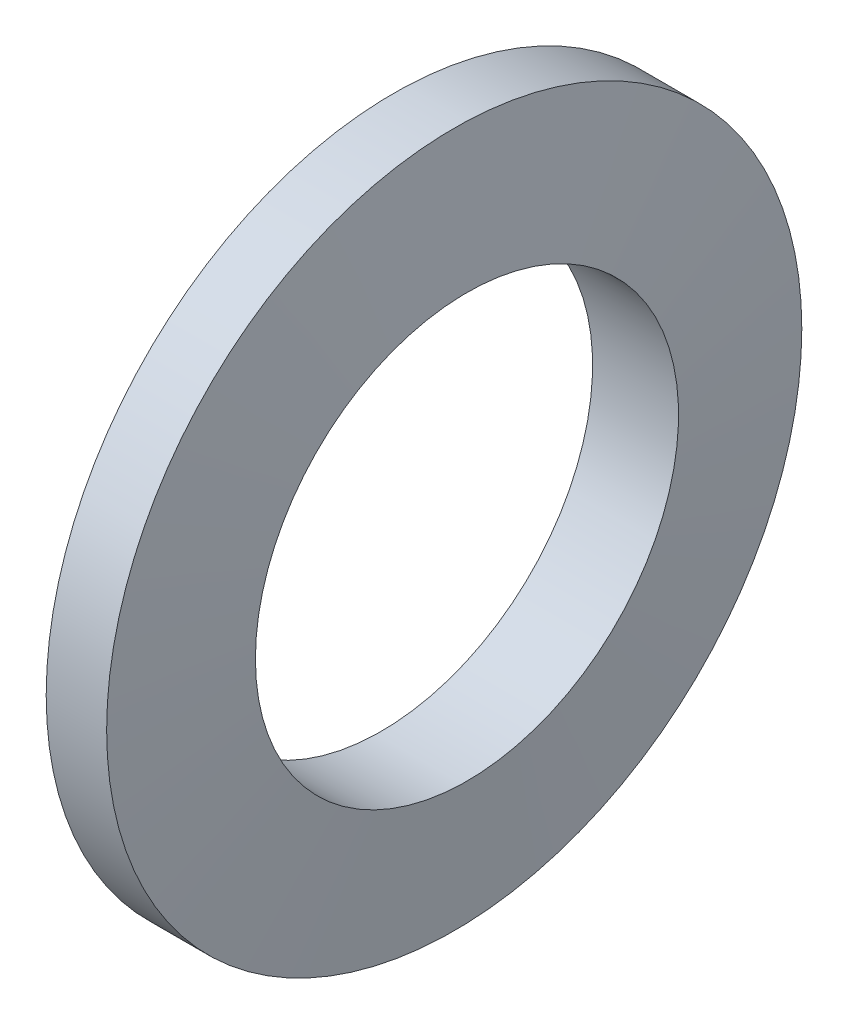
from build123d import *


with BuildPart() as part:
    # 草图1 → 旋转1 (revolve)
    with BuildSketch(Plane.XY, mode=Mode.PRIVATE) as revolve_1_sk:
        Polygon((-2, 23), (2, 23), (2.84375, 14), (-2.84375, 14), align=None)
    revolve(revolve_1_sk.sketch.rotate(Axis((0, 0, 0), (1, 0, 0)), 90), axis=Axis((0, 0, 0), (1, 0, 0)))


solid = part.part
